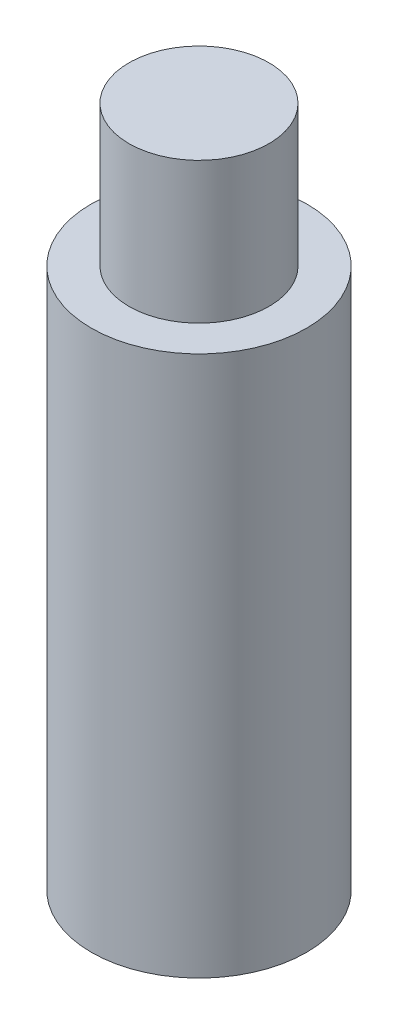
from build123d import *

# Parameters (mm, degrees)
SKETCH1_R           = 11.45
BOSS_EXTRUDE1_DEPTH = 57.5
SKETCH2_R           = 7.45
BOSS_EXTRUDE2_DEPTH = 15
CUT_EXTRUDE1_DEPTH  = 15


with BuildPart() as part:
    # Sketch1 → Boss-Extrude1 (new body)
    with BuildSketch(Plane(origin=(0, 0, 0), x_dir=(1, 0, 0), z_dir=(0, 1, 0))):
        with Locations(Location((0, 0, 0), (0, 0, 270))):
            Circle(SKETCH1_R)
    extrude(amount=BOSS_EXTRUDE1_DEPTH)

    # Sketch2 → Boss-Extrude2 (add)
    with BuildSketch(Plane(origin=(0, 57.5, 0), x_dir=(1, 0, 0), z_dir=(0, 1, 0))):
        with Locations(Location((0, 0, 0), (0, 0, 270))):
            Circle(SKETCH2_R)
    extrude(amount=BOSS_EXTRUDE2_DEPTH)

    # Sketch3 → Cut-Extrude1 (cut)
    with BuildSketch(Plane.XZ):
        with BuildLine():
            Line((1.547024754, 3.742888511), (-3.474906974, 2.080269579))
            ThreePointArc((-3.474906974, 2.080269579), (-1.079149377, -3.903579975), (4.05, 0))
            ThreePointArc((4.05, 0), (3.366596965, 2.251338462), (1.547024754, 3.742888511))
        make_face()
    extrude(amount=-CUT_EXTRUDE1_DEPTH, mode=Mode.SUBTRACT)


solid = part.part
